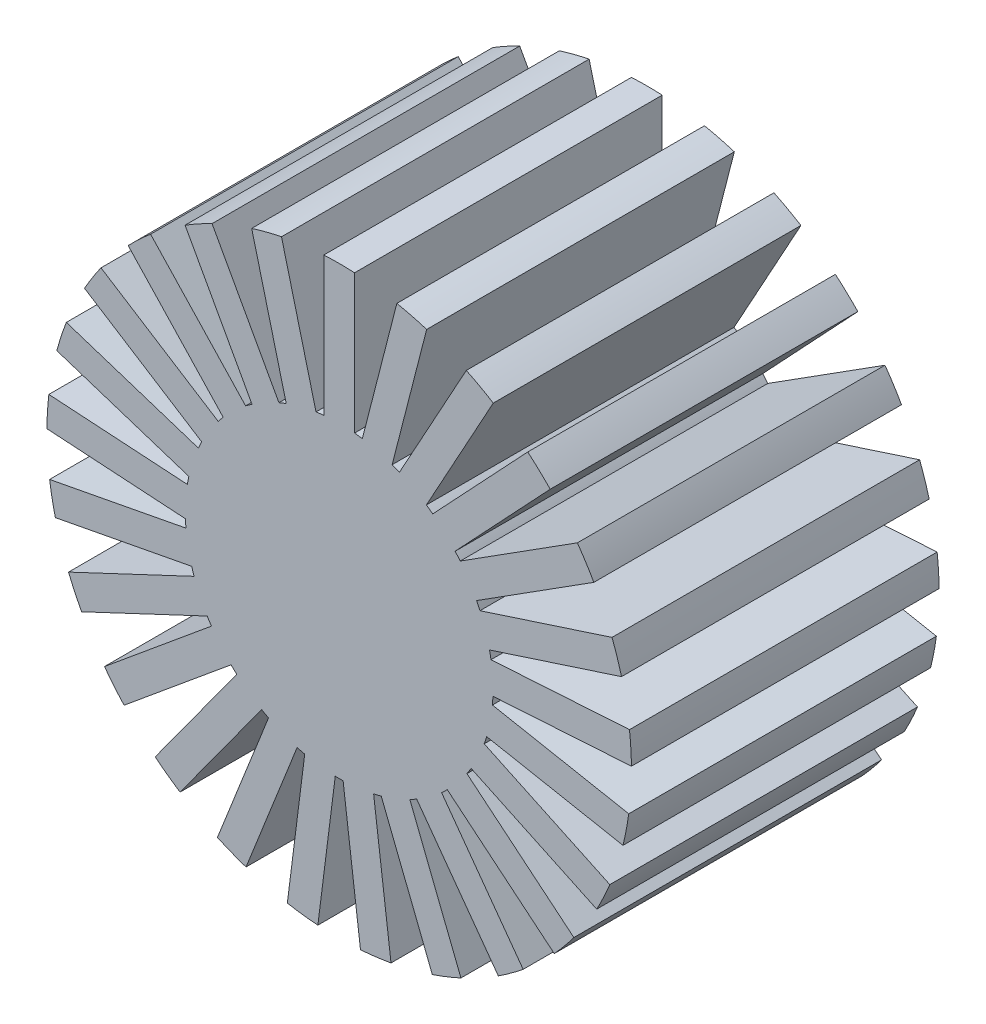
from build123d import *

# Parameters (mm, degrees)
EXTRUDE_1_DEPTH = 20


with BuildPart() as part:
    # 草图1 → 凸台-拉伸1 (new body)
    with BuildSketch(Plane.XY):
        with BuildLine():
            Line((3.749975686, 18.626263242), (1.505849974, 9.885970658))
            ThreePointArc((1.505849974, 9.885970658), (1.253332336, 9.921147013), (1, 9.949874371))
            Line((1, 9.949874371), (1, 18.973665961))
            ThreePointArc((1, 18.973665961), (0, 19), (-1, 18.973665961))
            Line((-1, 18.973665961), (-1, 9.949874371))
            ThreePointArc((-1, 9.949874371), (-1.253332336, 9.921147013), (-1.505849974, 9.885970658))
            Line((-1.505849974, 9.885970658), (-3.749975686, 18.626263242))
            ThreePointArc((-3.749975686, 18.626263242), (-4.725107856, 18.403080061), (-5.687142008, 18.128883468))
            Line((-5.687142008, 18.128883468), (-3.443016296, 9.388590884))
            ThreePointArc((-3.443016296, 9.388590884), (-3.681245527, 9.297764859), (-3.917081855, 9.200895051))
            Line((-3.917081855, 9.200895051), (-8.264326608, 17.108503901))
            ThreePointArc((-8.264326608, 17.108503901), (-9.153319808, 16.649826921), (-10.016939968, 16.144996552))
            Line((-10.016939968, 16.144996552), (-5.669695215, 8.237387703))
            ThreePointArc((-5.669695215, 8.237387703), (-5.877852523, 8.090169944), (-6.082189078, 7.937693369))
            Line((-6.082189078, 7.937693369), (-12.259399495, 14.515754339))
            ThreePointArc((-12.259399495, 14.515754339), (-13.006395013, 13.850403921), (-13.71733675, 13.146660127))
            Line((-13.71733675, 13.146660127), (-7.540126332, 6.568599157))
            ThreePointArc((-7.540126332, 6.568599157), (-7.705132428, 6.374239897), (-7.865129992, 6.17573722))
            Line((-7.865129992, 6.17573722), (-15.484169225, 11.010926546))
            ThreePointArc((-15.484169225, 11.010926546), (-16.042230585, 10.180709105), (-16.555822815, 9.322270695))
            Line((-16.555822815, 9.322270695), (-8.936783582, 4.487081369))
            ThreePointArc((-8.936783582, 4.487081369), (-9.048270525, 4.257792916), (-9.153875863, 4.025736789))
            Line((-9.153875863, 4.025736789), (-17.736011656, 6.814241744))
            ThreePointArc((-17.736011656, 6.814241744), (-18.07007381, 5.871322893), (-18.354045645, 4.912128711))
            Line((-18.354045645, 4.912128711), (-9.771909851, 2.123623756))
            ThreePointArc((-9.771909851, 2.123623756), (-9.822872507, 1.873813146), (-9.867450047, 1.622784509))
            Line((-9.867450047, 1.622784509), (-18.873435246, 2.189393071))
            ThreePointArc((-18.873435246, 2.189393071), (-18.96250784, 1.193019871), (-18.999016285, 0.193339615))
            Line((-18.999016285, 0.193339615), (-9.993031086, -0.373268947))
            ThreePointArc((-9.993031086, -0.373268947), (-9.980267284, -0.627905195), (-9.961016056, -0.882133289))
            Line((-9.961016056, -0.882133289), (-18.824971488, -2.57302322))
            ThreePointArc((-18.824971488, -2.57302322), (-18.663457764, -3.560244977), (-18.450208858, -4.537597721))
            Line((-18.450208858, -4.537597721), (-9.586253426, -2.84670779))
            ThreePointArc((-9.586253426, -2.84670779), (-9.510565163, -3.090169944), (-9.428694791, -3.331623408))
            Line((-9.428694791, -3.331623408), (-17.593665538, -7.173766999))
            ThreePointArc((-17.593665538, -7.173766999), (-17.191713997, -8.08980654), (-16.742106954, -8.983421104))
            Line((-16.742106954, -8.983421104), (-8.577136208, -5.141277513))
            ThreePointArc((-8.577136208, -5.141277513), (-8.443279255, -5.35826795), (-8.303933957, -5.571775376))
            Line((-8.303933957, -5.571775376), (-15.256884877, -11.323756614))
            ThreePointArc((-15.256884877, -11.323756614), (-14.639751613, -12.111055805), (-13.982036897, -12.8647831))
            Line((-13.982036897, -12.8647831), (-7.029085977, -7.112801862))
            ThreePointArc((-7.029085977, -7.112801862), (-6.845471059, -7.289686274), (-6.657406412, -7.461832206))
            Line((-6.657406412, -7.461832206), (-11.961458028, -14.762232956))
            ThreePointArc((-11.961458028, -14.762232956), (-11.167919794, -15.371322893), (-10.343424039, -15.93780346))
            Line((-10.343424039, -15.93780346), (-5.039372423, -8.63740271))
            ThreePointArc((-5.039372423, -8.63740271), (-4.817536741, -8.7630668), (-4.592569538, -8.883034675))
            Line((-4.592569538, -8.883034675), (-7.914448781, -17.273143909))
            ThreePointArc((-7.914448781, -17.273143909), (-6.994366501, -17.665753232), (-6.054895809, -18.009393014))
            Line((-6.054895809, -18.009393014), (-2.733016566, -9.61928378))
            ThreePointArc((-2.733016566, -9.61928378), (-2.486898872, -9.685831611), (-2.23916463, -9.746083406))
            Line((-2.23916463, -9.746083406), (-3.370145609, -18.698719704))
            ThreePointArc((-3.370145609, -18.698719704), (-2.381331438, -18.850179325), (-1.385916206, -18.949386171))
            Line((-1.385916206, -18.949386171), (-0.254935227, -9.996749873))
            ThreePointArc((-0.254935227, -9.996749873), (0, -10), (0.254935227, -9.996749873))
            Line((0.254935227, -9.996749873), (1.385916206, -18.949386171))
            ThreePointArc((1.385916206, -18.949386171), (2.381331438, -18.850179325), (3.370145609, -18.698719704))
            Line((3.370145609, -18.698719704), (2.23916463, -9.746083406))
            ThreePointArc((2.23916463, -9.746083406), (2.486898872, -9.685831611), (2.733016566, -9.61928378))
            Line((2.733016566, -9.61928378), (6.054895809, -18.009393014))
            ThreePointArc((6.054895809, -18.009393014), (6.994366501, -17.665753232), (7.914448781, -17.273143909))
            Line((7.914448781, -17.273143909), (4.592569538, -8.883034675))
            ThreePointArc((4.592569538, -8.883034675), (4.817536741, -8.7630668), (5.039372423, -8.63740271))
            Line((5.039372423, -8.63740271), (10.343424039, -15.93780346))
            ThreePointArc((10.343424039, -15.93780346), (11.167919794, -15.371322893), (11.961458028, -14.762232956))
            Line((11.961458028, -14.762232956), (6.657406412, -7.461832206))
            ThreePointArc((6.657406412, -7.461832206), (6.845471059, -7.289686274), (7.029085977, -7.112801862))
            Line((7.029085977, -7.112801862), (13.982036897, -12.8647831))
            ThreePointArc((13.982036897, -12.8647831), (14.639751613, -12.111055805), (15.256884877, -11.323756614))
            Line((15.256884877, -11.323756614), (8.303933957, -5.571775376))
            ThreePointArc((8.303933957, -5.571775376), (8.443279255, -5.35826795), (8.577136208, -5.141277513))
            Line((8.577136208, -5.141277513), (16.742106954, -8.983421104))
            ThreePointArc((16.742106954, -8.983421104), (17.191713997, -8.08980654), (17.593665538, -7.173766999))
            Line((17.593665538, -7.173766999), (9.428694791, -3.331623408))
            ThreePointArc((9.428694791, -3.331623408), (9.510565163, -3.090169944), (9.586253426, -2.84670779))
            Line((9.586253426, -2.84670779), (18.450208858, -4.537597721))
            ThreePointArc((18.450208858, -4.537597721), (18.663457764, -3.560244977), (18.824971488, -2.57302322))
            Line((18.824971488, -2.57302322), (9.961016056, -0.882133289))
            ThreePointArc((9.961016056, -0.882133289), (9.980267284, -0.627905195), (9.993031086, -0.373268947))
            Line((9.993031086, -0.373268947), (18.999016285, 0.193339615))
            ThreePointArc((18.999016285, 0.193339615), (18.96250784, 1.193019871), (18.873435246, 2.189393071))
            Line((18.873435246, 2.189393071), (9.867450047, 1.622784509))
            ThreePointArc((9.867450047, 1.622784509), (9.822872507, 1.873813146), (9.771909851, 2.123623756))
            Line((9.771909851, 2.123623756), (18.354045645, 4.912128711))
            ThreePointArc((18.354045645, 4.912128711), (18.07007381, 5.871322893), (17.736011656, 6.814241744))
            Line((17.736011656, 6.814241744), (9.153875863, 4.025736789))
            ThreePointArc((9.153875863, 4.025736789), (9.048270525, 4.257792916), (8.936783582, 4.487081369))
            Line((8.936783582, 4.487081369), (16.555822815, 9.322270695))
            ThreePointArc((16.555822815, 9.322270695), (16.042230585, 10.180709105), (15.484169225, 11.010926546))
            Line((15.484169225, 11.010926546), (7.865129992, 6.17573722))
            ThreePointArc((7.865129992, 6.17573722), (7.705132428, 6.374239897), (7.540126332, 6.568599157))
            Line((7.540126332, 6.568599157), (13.71733675, 13.146660127))
            ThreePointArc((13.71733675, 13.146660127), (13.006395013, 13.850403921), (12.259399495, 14.515754339))
            Line((12.259399495, 14.515754339), (6.082189078, 7.937693369))
            ThreePointArc((6.082189078, 7.937693369), (5.877852523, 8.090169944), (5.669695215, 8.237387703))
            Line((5.669695215, 8.237387703), (10.016939968, 16.144996552))
            ThreePointArc((10.016939968, 16.144996552), (9.153319808, 16.649826921), (8.264326608, 17.108503901))
            Line((8.264326608, 17.108503901), (3.917081855, 9.200895051))
            ThreePointArc((3.917081855, 9.200895051), (3.681245527, 9.297764859), (3.443016296, 9.388590884))
            Line((3.443016296, 9.388590884), (5.687142008, 18.128883468))
            ThreePointArc((5.687142008, 18.128883468), (4.725107856, 18.403080061), (3.749975686, 18.626263242))
        make_face()
    extrude(amount=EXTRUDE_1_DEPTH)


solid = part.part
